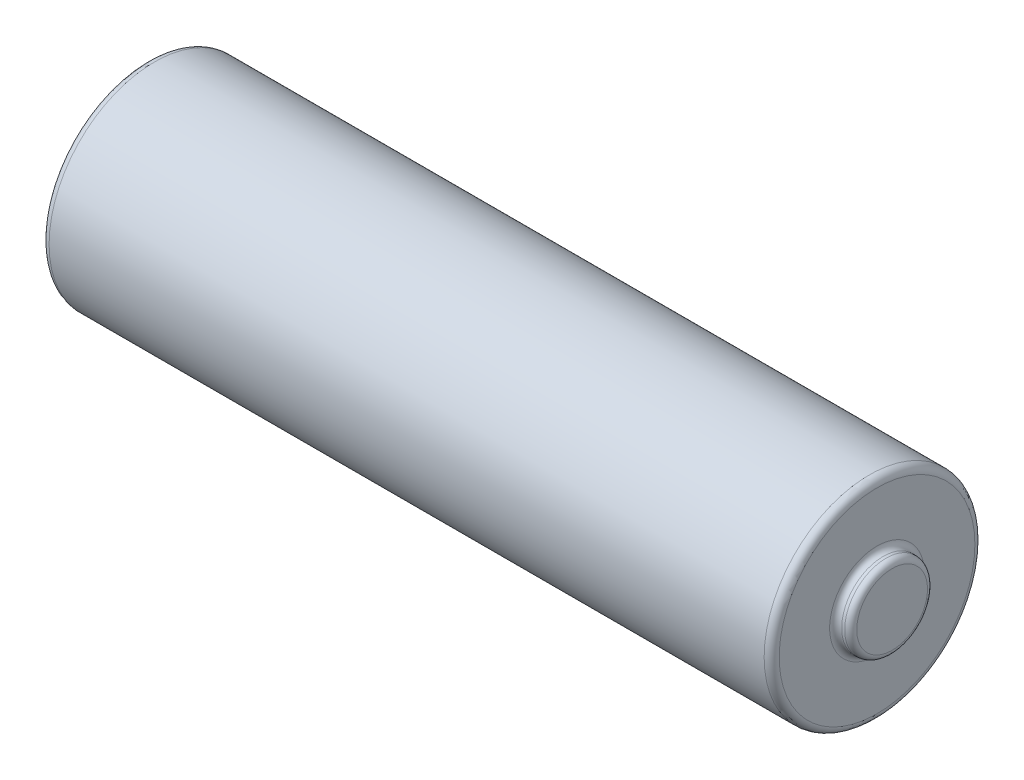
from build123d import *

# Parameters (mm, degrees)
BOSS_EXTRUDE1_DEPTH     = 2.75
SKETCH2_W               = 120
SKETCH2_H               = 29
CUT_EXTRUDE1_DEPTH      = 0.125
SKETCH3_W               = 120
SKETCH3_H               = 29
BOSS_EXTRUDE2_DEPTH     = 0.125
CUT_EXTRUDE2_DEPTH      = 1.356
FILLET1_R               = 2
BOSS_EXTRUDE3_DEPTH     = 0.1
SKETCH6_W               = 0.5
SKETCH6_H               = 5
BOSS_EXTRUDE4_DEPTH     = 0.1
BOSS_EXTRUDE4_2_DEPTH   = 0.1
BOSS_EXTRUDE4_3_DEPTH   = 0.1
SKETCH7_W               = 30
SKETCH7_H               = 10
BOSS_EXTRUDE5_DEPTH     = 0.1
SKETCH8_RX              = 5
SKETCH8_RY              = 4
CUT_EXTRUDE3_DEPTH      = 1.15
CUT_EXTRUDE4_DEPTH      = 121.904145917
CUT_EXTRUDE4_DEPTH_BACK = 121.904145917
SKETCH9_W               = 0.2
SKETCH9_H               = 2
SKETCH10_W              = 120
SKETCH10_H              = 29
BOSS_EXTRUDE6_DEPTH     = 1.619
BOSS_EXTRUDE7_START     = 45
SKETCH11_R              = 7
BOSS_EXTRUDE7_DEPTH     = 48.5
SKETCH12_R              = 4.25
BOSS_EXTRUDE8_DEPTH     = 1
SKETCH13_R              = 2.75
BOSS_EXTRUDE9_DEPTH     = 1
BOSS_EXTRUDE10_START    = 44
SKETCH14_R              = 7
BOSS_EXTRUDE10_DEPTH    = 48.5
SKETCH15_R              = 2.75
BOSS_EXTRUDE11_DEPTH    = 1
SKETCH16_R              = 4.25
BOSS_EXTRUDE12_DEPTH    = 1
FILLET2_R               = 0.5
FILLET3_R               = 0.5
FILLET4_R               = 0.4
FILLET5_R               = 0.4
FILLET6_R               = 0.4
FILLET7_R               = 0.4


with BuildPart() as part:
    # Sketch1 → Boss-Extrude1 (new body)
    with BuildSketch(Plane(origin=(0, 0, 0), x_dir=(1, 0, 0), z_dir=(0, 1, 0))):
        Polygon((0, 0), (0, -14.5), (120, -14.5), (120, 14.5), (0, 14.5), align=None)
    extrude(amount=BOSS_EXTRUDE1_DEPTH)

    # Sketch2 → Cut-Extrude1 (cut)
    with BuildSketch(Plane(origin=(0, 2.75, 0), x_dir=(1, 0, 0), z_dir=(0, 1, 0))):
        with Locations((60, 0)):
            Rectangle(SKETCH2_W, SKETCH2_H)
    extrude(amount=-CUT_EXTRUDE1_DEPTH, mode=Mode.SUBTRACT)

    # Sketch4 → Cut-Extrude2 (cut)
    with BuildSketch(Plane(origin=(0, 2.625, 0), x_dir=(1, 0, 0), z_dir=(0, 1, 0))):
        Polygon((77.5, 0), (77.5, -2.5), (92.5, -2.5), (92.5, 2.5), (77.5, 2.5), align=None)
    extrude(amount=-CUT_EXTRUDE2_DEPTH, mode=Mode.SUBTRACT)

    # Fillet1
    fillet1_edges = [part.edges().sort_by_distance(p)[0] for p in [
        (77.5, 1.947, -2.5),
        (92.5, 1.947, -2.5),
        (92.5, 1.947, 2.5),
        (77.5, 1.947, 2.5),
    ]]
    fillet(fillet1_edges, radius=FILLET1_R)

    # Sketch8 → Cut-Extrude3 (cut)
    with BuildSketch(Plane(origin=(0, 2.625, 0), x_dir=(1, 0, 0), z_dir=(0, 1, 0))):
        with Locations(Location((16.87, 0), (0, 0, -90))):
            Ellipse(SKETCH8_RX, SKETCH8_RY)
    extrude(amount=-CUT_EXTRUDE3_DEPTH, mode=Mode.SUBTRACT)


with BuildPart() as body_2:
    # Sketch3 → Boss-Extrude2 (new body)
    with BuildSketch(Plane(origin=(0, 2.625, 0), x_dir=(1, 0, 0), z_dir=(0, 1, 0))):
        with Locations((60, 0)):
            Rectangle(SKETCH3_W, SKETCH3_H)
    extrude(amount=BOSS_EXTRUDE2_DEPTH)

    # Sketch9 → Cut-Extrude4 (cut, two sides: drawn at the far end of the back side and taken through both)
    with BuildSketch(Plane(origin=(0, 2.75, 0), x_dir=(1, 0, 0), z_dir=(0, 1, 0)).offset(-CUT_EXTRUDE4_DEPTH_BACK)):
        with Locations((35, 3.5)):
            Rectangle(SKETCH9_W, SKETCH9_H)
        with Locations((35, 0)):
            Rectangle(SKETCH9_W, SKETCH9_H)
        with Locations((35, 7)):
            Rectangle(SKETCH9_W, SKETCH9_H)
        with Locations((35, 10.5)):
            Rectangle(SKETCH9_W, SKETCH9_H)
        with Locations((35, 14)):
            Rectangle(SKETCH9_W, SKETCH9_H)
        with Locations((35, -10.5)):
            Rectangle(SKETCH9_W, SKETCH9_H)
        with Locations((35, -14)):
            Rectangle(SKETCH9_W, SKETCH9_H)
        with Locations((35, -7)):
            Rectangle(SKETCH9_W, SKETCH9_H)
        with Locations((35, -3.5)):
            Rectangle(SKETCH9_W, SKETCH9_H)
    extrude(amount=CUT_EXTRUDE4_DEPTH + CUT_EXTRUDE4_DEPTH_BACK, mode=Mode.SUBTRACT)


with BuildPart() as body_3:
    # Sketch5 → Boss-Extrude3 (new body)
    with BuildSketch(Plane(origin=(0, 1.269, 0), x_dir=(1, 0, 0), z_dir=(0, 1, 0))):
        with BuildLine():
            Line((90.5, 2.5), (79.5, 2.5))
            ThreePointArc((79.5, 2.5), (78.085786438, 1.914213562), (77.5, 0.5))
            Line((77.5, 0.5), (77.5, -0.5))
            ThreePointArc((77.5, -0.5), (78.085786438, -1.914213562), (79.5, -2.5))
            Line((79.5, -2.5), (90.5, -2.5))
            ThreePointArc((90.5, -2.5), (91.914213562, -1.914213562), (92.5, -0.5))
            Line((92.5, -0.5), (92.5, 0.5))
            ThreePointArc((92.5, 0.5), (91.914213562, 1.914213562), (90.5, 2.5))
        make_face()
    extrude(amount=BOSS_EXTRUDE3_DEPTH)


with BuildPart() as body_4:
    # Sketch6 → Boss-Extrude4 (new body)
    with BuildSketch(Plane(origin=(0, 1.369, 0), x_dir=(1, 0, 0), z_dir=(0, 1, 0))):
        with Locations((90, 0)):
            Rectangle(SKETCH6_W, SKETCH6_H)
    extrude(amount=BOSS_EXTRUDE4_DEPTH)


with BuildPart() as body_5:
    # Sketch6 → Boss-Extrude4 2 (new body)
    with BuildSketch(Plane(origin=(0, 1.369, 0), x_dir=(1, 0, 0), z_dir=(0, 1, 0))):
        with Locations((85, 0)):
            Rectangle(SKETCH6_W, SKETCH6_H)
    extrude(amount=BOSS_EXTRUDE4_2_DEPTH)


with BuildPart() as body_6:
    # Sketch6 → Boss-Extrude4 3 (new body)
    with BuildSketch(Plane(origin=(0, 1.369, 0), x_dir=(1, 0, 0), z_dir=(0, 1, 0))):
        with Locations((80, 0)):
            Rectangle(SKETCH6_W, SKETCH6_H)
    extrude(amount=BOSS_EXTRUDE4_3_DEPTH)


with BuildPart() as body_7:
    # Sketch7 → Boss-Extrude5 (new body)
    with BuildSketch(Plane(origin=(0, 2.625, 0), x_dir=(1, 0, 0), z_dir=(0, 1, 0))):
        with Locations((44, 0)):
            Rectangle(SKETCH7_W, SKETCH7_H)
    extrude(amount=BOSS_EXTRUDE5_DEPTH)


with BuildPart() as body_8:
    # Sketch10 → Boss-Extrude6 (new body)
    with BuildSketch(Plane.XZ):
        with Locations((60, 0)):
            Rectangle(SKETCH10_W, SKETCH10_H)
    extrude(amount=BOSS_EXTRUDE6_DEPTH)


with BuildPart() as body_9:
    # Sketch11 → Boss-Extrude7 (new body)
    with BuildSketch(Plane(origin=(0, 0, 0), x_dir=(0, 0, -1), z_dir=(1, 0, 0)).offset(BOSS_EXTRUDE7_START)):
        with Locations(Location((8.1, -9.869, 0), (0, 0, 180))):
            Circle(SKETCH11_R)
    extrude(amount=BOSS_EXTRUDE7_DEPTH)

    # Sketch12 → Boss-Extrude8 (add)
    with BuildSketch(Plane(origin=(93.5, 0, 0), x_dir=(0, 0, -1), z_dir=(1, 0, 0))):
        with Locations((8.1, -9.869)):
            Circle(SKETCH12_R)
    extrude(amount=BOSS_EXTRUDE8_DEPTH)

    # Sketch13 → Boss-Extrude9 (add)
    with BuildSketch(Plane.ZY.offset(-45)):
        with Locations((-8.1, -9.869)):
            Circle(SKETCH13_R)
    extrude(amount=BOSS_EXTRUDE9_DEPTH)

    # Fillet3
    fillet3_edges = [body_9.edges().sort_by_distance(p)[0] for p in [
        (45, -9.869, -15.1),
        (93.5, -9.869, -15.1),
    ]]
    fillet(fillet3_edges, radius=FILLET3_R)

    # Fillet5
    fillet5_edges = [body_9.edges().sort_by_distance(p)[0] for p in [
        (93.5, -9.869, -3.85),
        (94.5, -9.869, -3.85),
    ]]
    fillet(fillet5_edges, radius=FILLET5_R)

    # Fillet6
    fillet6_edges = [body_9.edges().sort_by_distance(p)[0] for p in [
        (45, -9.869, -10.85),
        (44, -9.869, -10.85),
    ]]
    fillet(fillet6_edges, radius=FILLET6_R)


with BuildPart() as body_10:
    # Sketch14 → Boss-Extrude10 (new body)
    with BuildSketch(Plane(origin=(0, 0, 0), x_dir=(0, 0, -1), z_dir=(1, 0, 0)).offset(BOSS_EXTRUDE10_START)):
        with Locations(Location((-8.1, -9.869, 0), (0, 0, 180))):
            Circle(SKETCH14_R)
    extrude(amount=BOSS_EXTRUDE10_DEPTH)

    # Sketch15 → Boss-Extrude11 (add)
    with BuildSketch(Plane(origin=(92.5, 0, 0), x_dir=(0, 0, -1), z_dir=(1, 0, 0))):
        with Locations((-8.1, -9.869)):
            Circle(SKETCH15_R)
    extrude(amount=BOSS_EXTRUDE11_DEPTH)

    # Sketch16 → Boss-Extrude12 (add)
    with BuildSketch(Plane.ZY.offset(-44)):
        with Locations((8.1, -9.869)):
            Circle(SKETCH16_R)
    extrude(amount=BOSS_EXTRUDE12_DEPTH)

    # Fillet2
    fillet2_edges = [body_10.edges().sort_by_distance(p)[0] for p in [
        (44, -9.869, 1.1),
        (92.5, -9.869, 1.1),
    ]]
    fillet(fillet2_edges, radius=FILLET2_R)

    # Fillet4
    fillet4_edges = [body_10.edges().sort_by_distance(p)[0] for p in [
        (92.5, -9.869, 10.85),
        (93.5, -9.869, 10.85),
    ]]
    fillet(fillet4_edges, radius=FILLET4_R)

    # Fillet7
    fillet7_edges = [body_10.edges().sort_by_distance(p)[0] for p in [
        (44, -9.869, 3.85),
        (43, -9.869, 3.85),
    ]]
    fillet(fillet7_edges, radius=FILLET7_R)


solid = body_10.part
